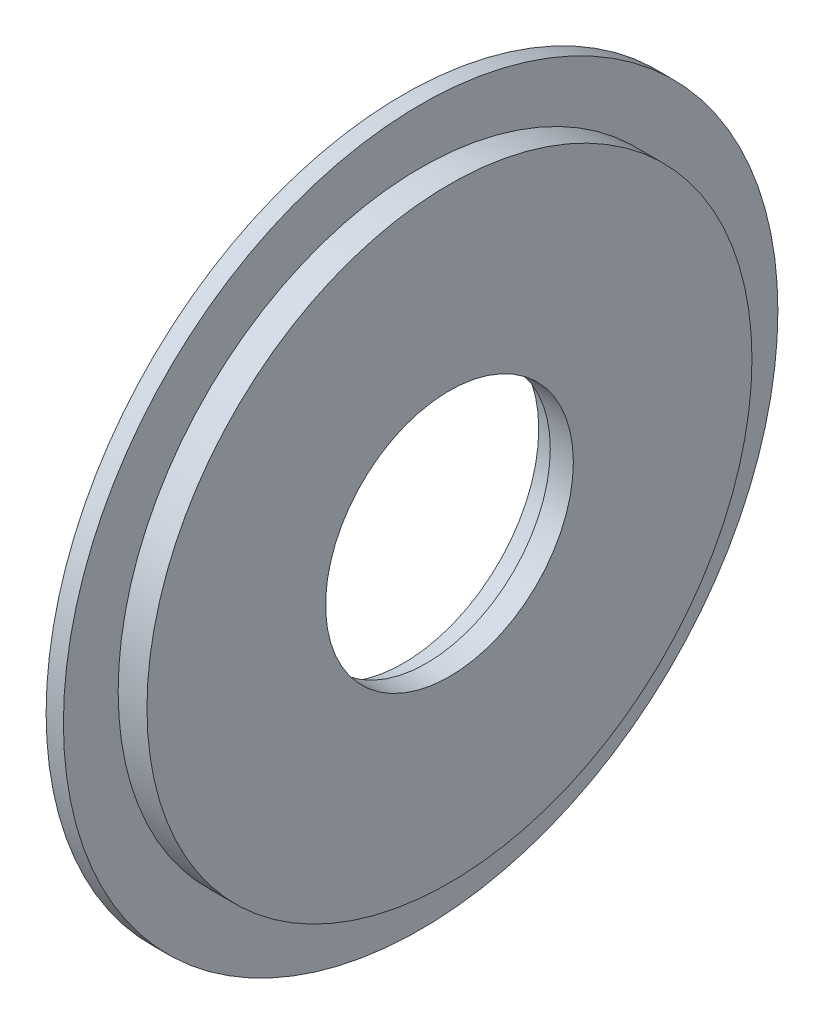
from build123d import *

# Parameters (mm, degrees)
CROQUIS11_R             = 62
CROQUIS11_R_2           = 20
SALIENTE_EXTRUIR3_DEPTH = 8
CROQUIS15_R             = 21.5
CORTAR_EXTRUIR4_DEPTH   = 89.045442812
CROQUIS16_R             = 23.5
CORTAR_EXTRUIR5_DEPTH   = 4
CROQUIS21_R             = 62
CROQUIS21_R_2           = 52.5
CORTAR_EXTRUIR10_DEPTH  = 5


with BuildPart() as part:
    # Croquis11 → Saliente-Extruir3 (new body)
    with BuildSketch(Plane(origin=(0, 0, 0), x_dir=(0, 0, -1), z_dir=(1, 0, 0))):
        Circle(CROQUIS11_R)
        Circle(CROQUIS11_R_2, mode=Mode.SUBTRACT)
    extrude(amount=-SALIENTE_EXTRUIR3_DEPTH)

    # Croquis15 → Cortar-Extruir4 (cut, through all)
    with BuildSketch(Plane(origin=(0, 0, 0), x_dir=(0, 0, -1), z_dir=(1, 0, 0))):
        Circle(CROQUIS15_R)
    extrude(amount=-CORTAR_EXTRUIR4_DEPTH, mode=Mode.SUBTRACT)

    # Croquis16 → Cortar-Extruir5 (cut)
    with BuildSketch(Plane.ZY.offset(8)):
        Circle(CROQUIS16_R)
    extrude(amount=-CORTAR_EXTRUIR5_DEPTH, mode=Mode.SUBTRACT)

    # Croquis21 → Cortar-Extruir10 (cut)
    with BuildSketch(Plane(origin=(0, 0, 0), x_dir=(0, 0, -1), z_dir=(1, 0, 0))):
        Circle(CROQUIS21_R)
        Circle(CROQUIS21_R_2, mode=Mode.SUBTRACT)
    extrude(amount=-CORTAR_EXTRUIR10_DEPTH, mode=Mode.SUBTRACT)


solid = part.part
